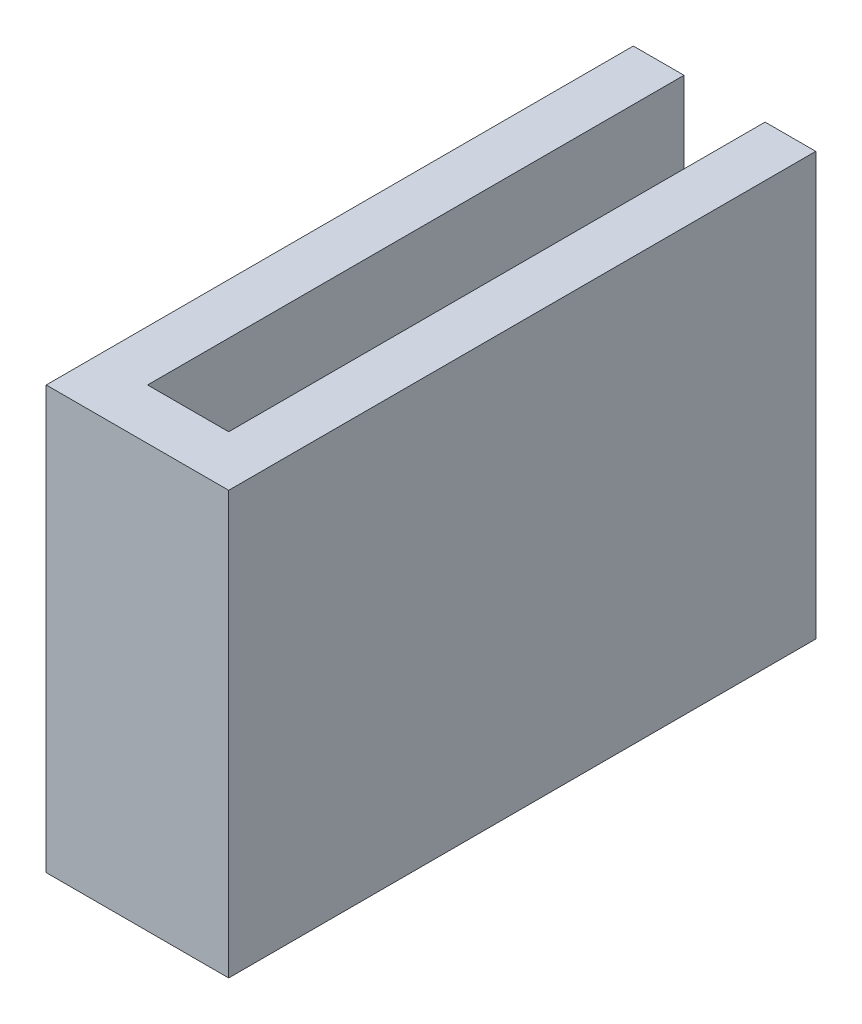
from build123d import *

# Parameters (mm, degrees)
BOSS_EXTRUDE1_DEPTH = 25


with BuildPart() as part:
    # Sketch1 → Boss-Extrude1 (new body)
    with BuildSketch(Plane(origin=(0, 0, 0), x_dir=(1, 0, 0), z_dir=(0, 1, 0))):
        Polygon((0, 0), (0, 34.75), (3, 34.75), (3, 3), (7.8, 3), (7.8, 34.75), (10.8, 34.75), (10.8, 0), align=None)
    extrude(amount=BOSS_EXTRUDE1_DEPTH)


solid = part.part
